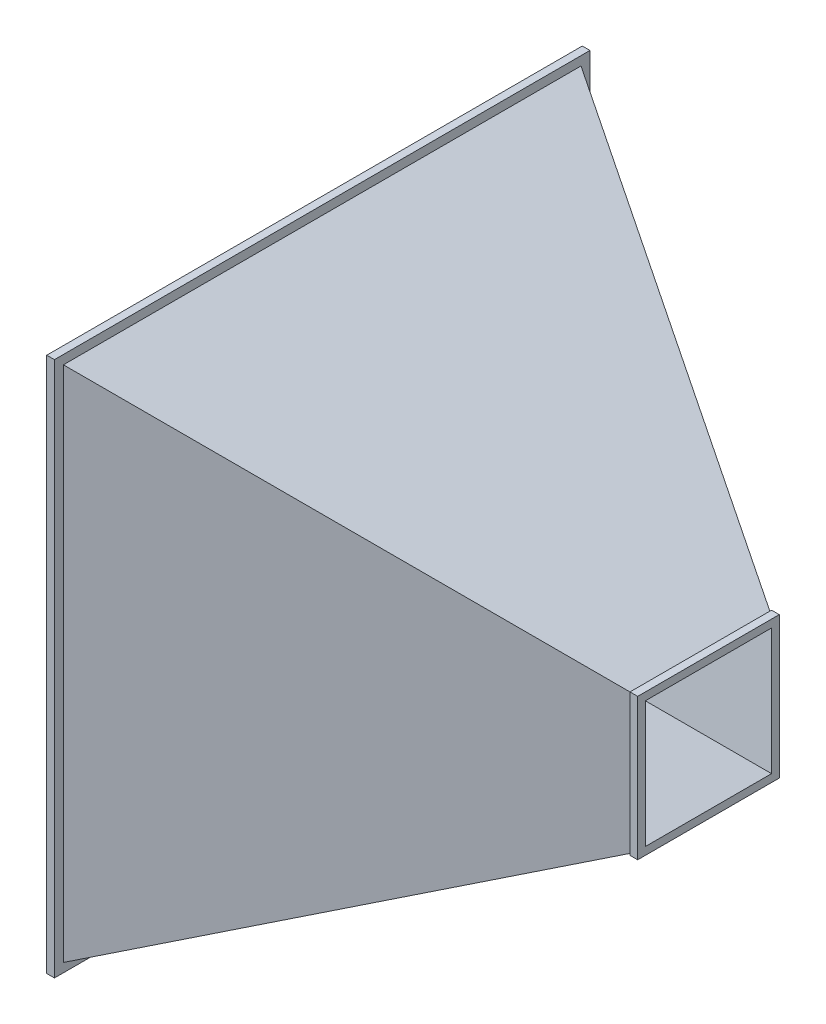
from build123d import *

# Parameters (mm, degrees)
SKETCH11_W          = 276
SKETCH11_H          = 276
BOSS_EXTRUDE7_DEPTH = 15
SKETCH12_W          = 1044
SKETCH12_H          = 1044
BOSS_EXTRUDE8_DEPTH = 15


with BuildPart() as part:
    # Sketch1 → Loft3 section 0
    with BuildSketch(Plane(origin=(0, 0, 0), x_dir=(0, 0, -1), z_dir=(1, 0, 0))):
        with BuildLine():
            Line((-512, -512), (512, -512))
            Line((512, -512), (512, 512))
            Line((512, 512), (-512, 512))
            Line((-512, 512), (-512, -512))
        make_face()
    # Sketch2 → Loft3 section 1
    with BuildSketch(Plane(origin=(768, 0, 0), x_dir=(0, 0, -1), z_dir=(1, 0, 0))):
        with BuildLine():
            Line((-128, 128), (128, 128))
            Line((128, 128), (128, -128))
            Line((128, -128), (-128, -128))
            Line((-128, -128), (-128, 128))
        make_face()
    loft()

    # Sketch11 → Boss-Extrude7 (add)
    with BuildSketch(Plane(origin=(768, 0, 0), x_dir=(0, 0, -1), z_dir=(1, 0, 0))):
        Rectangle(SKETCH11_W, SKETCH11_H)
    extrude(amount=-BOSS_EXTRUDE7_DEPTH)

    # Sketch12 → Boss-Extrude8 (add)
    with BuildSketch(Plane.ZY):
        Rectangle(SKETCH12_W, SKETCH12_H)
    extrude(amount=-BOSS_EXTRUDE8_DEPTH)

    # Sketch13 → Cut-Loft4 section 0
    with BuildSketch(Plane.ZY):
        with BuildLine():
            Line((-512, 512), (512, 512))
            Line((512, 512), (512, -512))
            Line((512, -512), (-512, -512))
            Line((-512, -512), (-512, 512))
        make_face()
    # Sketch3 → Cut-Loft4 section 1
    with BuildSketch(Plane(origin=(768, 0, 0), x_dir=(0, 0, -1), z_dir=(1, 0, 0))):
        with BuildLine():
            Line((-123, 123), (123, 123))
            Line((123, 123), (123, -123))
            Line((123, -123), (-123, -123))
            Line((-123, -123), (-123, 123))
        make_face()
    loft(mode=Mode.SUBTRACT)


solid = part.part
